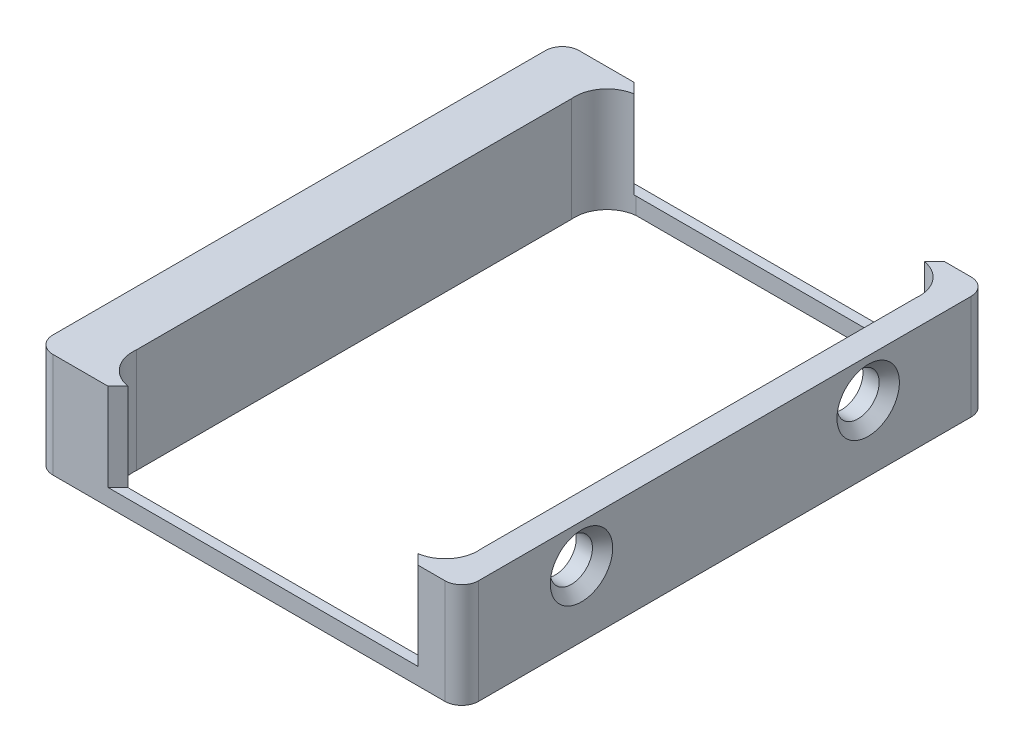
from build123d import *

# Parameters (mm, degrees)
SKETCH_1_W          = 126.2
SKETCH_1_H          = 156
EXTRUDE_1_DEPTH     = 31
CUT_EXTRUDE_START   = -26
CUT_EXTRUDE_1_DEPTH = 26
FILLET_1_R          = 5
F_12_0MM_1_D        = 12.5
F_12_0MM_1_DEPTH    = 17
F_12_0MM_1_TIP      = 3.755378869
SKETCH_6_R          = 2.1
CUT_EXTRUDE_2_DEPTH = 10
SKETCH_7_R          = 2.1
CUT_EXTRUDE_3_DEPTH = 10
CHAMFER_1_SIZE      = 3


with BuildPart() as part:
    # 草图1 → 凸台-拉伸1 (new body)
    with BuildSketch(Plane(origin=(0, 0, 0), x_dir=(1, 0, 0), z_dir=(0, 1, 0))):
        with Locations((-4.2, 0)):
            Rectangle(SKETCH_1_W, SKETCH_1_H)
        with BuildLine():
            Line((-42.5, 75.1), (42.5, 75.1))
            ThreePointArc((42.5, 75.1), (48.995331881, 71.581118318), (51.1, 64.5))
            Line((51.1, 64.5), (51.1, -64.5))
            ThreePointArc((51.1, -64.5), (48.995331881, -71.581118318), (42.5, -75.1))
            Line((42.5, -75.1), (-42.5, -75.1))
            ThreePointArc((-42.5, -75.1), (-48.995331881, -71.581118318), (-51.1, -64.5))
            Line((-51.1, -64.5), (-51.1, 64.5))
            ThreePointArc((-51.1, 64.5), (-48.995331881, 71.581118318), (-42.5, 75.1))
        make_face(mode=Mode.SUBTRACT)
    extrude(amount=EXTRUDE_1_DEPTH)

    # 草图2 → 切除-拉伸1 (cut)
    with BuildSketch(Plane(origin=(0, 31, 0), x_dir=(1, 0, 0), z_dir=(0, 1, 0)).offset(CUT_EXTRUDE_START)):
        with BuildLine():
            Line((-42.780928277, -74.780928277), (-43.029918625, -75.029918625))
            ThreePointArc((-43.029918625, -75.029918625), (-42.765444551, -75.068628433), (-42.5, -75.1))
            Line((-42.5, -75.1), (-42.780928277, -74.780928277))
        make_face()
        with BuildLine():
            Line((-43.029918625, -75.029918625), (-43.1, -75.1))
            Line((-43.1, -75.1), (-42.5, -75.1))
            ThreePointArc((-42.5, -75.1), (-42.765444551, -75.068628433), (-43.029918625, -75.029918625))
        make_face()
        Polygon((43.1, -75.1), (42.5, -75.1), (-42.5, -75.1), (-43.1, -75.1), (-46, -78), (46, -78), align=None)
        with BuildLine():
            ThreePointArc((42.5, -75.1), (42.765444551, -75.068628433), (43.029918625, -75.029918625))
            Line((43.029918625, -75.029918625), (42.872377268, -74.872377268))
            Line((42.872377268, -74.872377268), (42.5, -75.1))
        make_face()
        with BuildLine():
            Line((42.5, -75.1), (43.1, -75.1))
            Line((43.1, -75.1), (43.029918625, -75.029918625))
            ThreePointArc((43.029918625, -75.029918625), (42.765444551, -75.068628433), (42.5, -75.1))
        make_face()
        Polygon((46, 78), (-46, 78), (-43.1, 75.1), (-42.5, 75.1), (42.5, 75.1), (43.1, 75.1), align=None)
        with BuildLine():
            Line((-42.780928277, 74.780928277), (-42.5, 75.1))
            ThreePointArc((-42.5, 75.1), (-42.765444551, 75.068628433), (-43.029918625, 75.029918625))
            Line((-43.029918625, 75.029918625), (-42.780928277, 74.780928277))
        make_face()
        with BuildLine():
            Line((-42.5, 75.1), (-43.1, 75.1))
            Line((-43.1, 75.1), (-43.029918625, 75.029918625))
            ThreePointArc((-43.029918625, 75.029918625), (-42.765444551, 75.068628433), (-42.5, 75.1))
        make_face()
        with BuildLine():
            ThreePointArc((43.029918625, 75.029918625), (42.765444551, 75.068628433), (42.5, 75.1))
            Line((42.5, 75.1), (42.872377268, 74.872377268))
            Line((42.872377268, 74.872377268), (43.029918625, 75.029918625))
        make_face()
        with BuildLine():
            Line((43.029918625, 75.029918625), (43.1, 75.1))
            Line((43.1, 75.1), (42.5, 75.1))
            ThreePointArc((42.5, 75.1), (42.765444551, 75.068628433), (43.029918625, 75.029918625))
        make_face()
    extrude(amount=CUT_EXTRUDE_1_DEPTH, mode=Mode.SUBTRACT)

    # 圆角1
    fillet_1_edges = [part.edges().sort_by_distance(p)[0] for p in [
        (58.9, 15.5, -78),
        (58.9, 15.5, 78),
        (-67.3, 15.5, 78),
        (-67.3, 15.5, -78),
    ]]
    fillet(fillet_1_edges, radius=FILLET_1_R)

    # Ø12.0mm 暗销孔1
    with Locations(Plane(origin=(58.9, 0, 0), x_dir=(0, 0, -1), z_dir=(1, 0, 0))):
        with Locations((42.5, 19.55), (-42.5, 19.55)):
            Hole(F_12_0MM_1_D / 2, depth=F_12_0MM_1_DEPTH)
            with Locations((0, 0, -(F_12_0MM_1_DEPTH + F_12_0MM_1_TIP / 2))):  # 118° drill point
                Cone(0, F_12_0MM_1_D / 2, F_12_0MM_1_TIP, mode=Mode.SUBTRACT)

    # 草图6 → 切除-拉伸2 (cut)
    with BuildSketch(Plane.ZY.offset(67.3)):
        with Locations((-11, 13.95)):
            Circle(SKETCH_6_R)
        with Locations(Location((11, 13.95, 0), (0, 0, 180))):
            Circle(SKETCH_6_R)
    extrude(amount=-CUT_EXTRUDE_2_DEPTH, mode=Mode.SUBTRACT)

    # 草图7 → 切除-拉伸3 (cut)
    with BuildSketch(Plane.XZ):
        with Locations(Location((-58.493442579, 70.964337058, 0), (0, 0, 270))):
            Circle(SKETCH_7_R)
        with Locations(Location((53.705008218, 73.348219362, 0), (0, 0, 270))):
            Circle(SKETCH_7_R)
        with Locations(Location((-58.493442579, -70.964337058, 0), (0, 0, 270))):
            Circle(SKETCH_7_R)
        with Locations(Location((53.705008218, -73.348219362, 0), (0, 0, 270))):
            Circle(SKETCH_7_R)
    extrude(amount=-CUT_EXTRUDE_3_DEPTH, mode=Mode.SUBTRACT)

    # 倒角1
    chamfer_1_edges = [part.edges().sort_by_distance(p)[0] for p in [
        (58.9, 19.55, 36.25),
        (58.9, 19.55, -48.75),
    ]]
    chamfer(chamfer_1_edges, length=CHAMFER_1_SIZE)


solid = part.part
